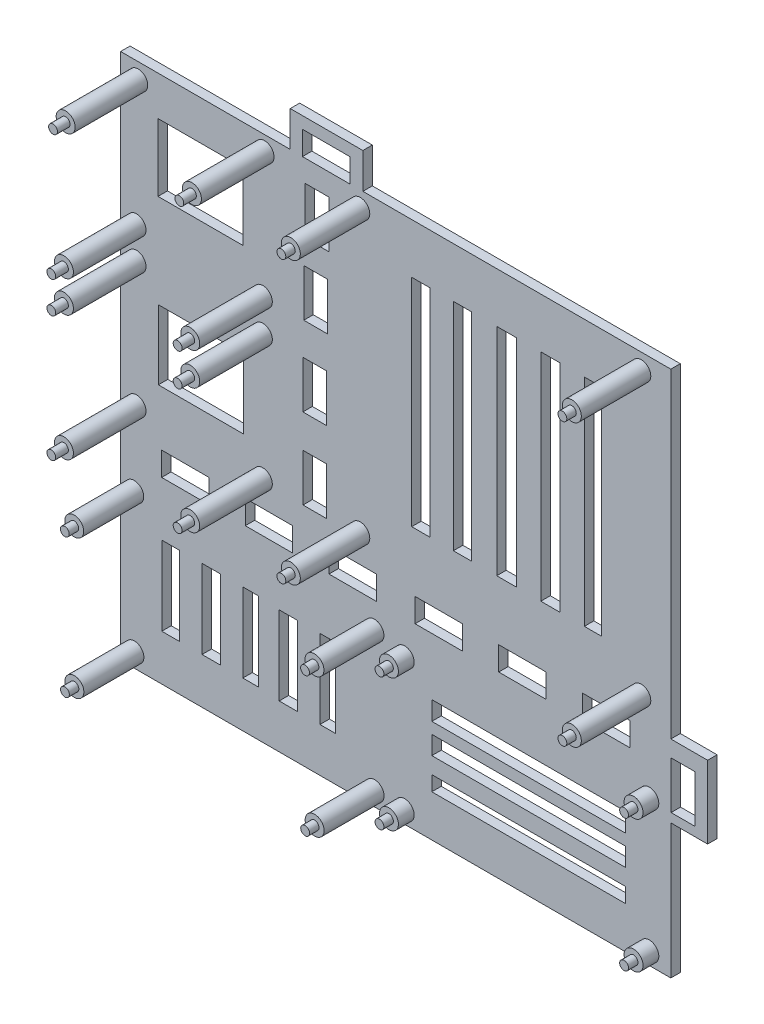
from build123d import *

# Parameters (mm, degrees)
SKETCH1_W            = 15
SKETCH1_H            = 7.5
SKETCH1_R            = 3
SKETCH1_W_2          = 5.688771298
SKETCH1_H_2          = 25
SKETCH1_W_3          = 5.842521873
SKETCH1_W_4          = 4.920018419
SKETCH1_W_5          = 5.842521874
SKETCH1_W_6          = 7.5
SKETCH1_H_3          = 15
SKETCH1_W_7          = 61.334124095
SKETCH1_H_4          = 4.704767614
SKETCH1_H_5          = 5.842521873
SKETCH1_H_6          = 5.974747368
SKETCH1_W_8          = 26.922884563
SKETCH1_H_7          = 21.985461589
SKETCH1_W_9          = 26.922884564
SKETCH1_H_8          = 21.350774687
SKETCH1_W_10         = 5.769189549
SKETCH1_H_9          = 68.406104657
SKETCH1_W_11         = 6.318636173
SKETCH1_W_12         = 6.107283803
SKETCH1_W_13         = 5.494466237
BOSS_EXTRUDE3_DEPTH  = 3
SKETCH1_6_R          = 3
BOSS_EXTRUDE4_DEPTH  = 26
SKETCH1_8_R          = 3
BOSS_EXTRUDE5_DEPTH  = 22
SKETCH1_10_R         = 3
BOSS_EXTRUDE6_DEPTH  = 8
SKETCH1_11_R         = 3
BOSS_EXTRUDE7_DEPTH  = 25
SKETCH1_12_R         = 1.4
BOSS_EXTRUDE8_DEPTH  = 30
SKETCH1_13_R         = 1.4
BOSS_EXTRUDE9_DEPTH  = 25
SKETCH1_15_R         = 1.4
BOSS_EXTRUDE10_DEPTH = 11
SKETCH1_16_R         = 1.4
BOSS_EXTRUDE11_DEPTH = 28


with BuildPart() as part:
    # Sketch1 → Boss-Extrude3 (new body)
    with BuildSketch(Plane.XY):
        Polygon((-20.116410516, 63.581349206), (-73.848571429, 63.581349206), (-73.848571429, -103.418650794), (100.413183268, -103.418650794), (100.413183268, -60.85880545), (112.070531086, -60.85880545), (112.070531086, -37.85880545), (100.413183268, -37.85880545), (100.413183268, 63.581349206), (2.883589484, 63.581349206), (2.883589484, 74.791587762), (-20.116410516, 74.791587762), align=None)
        with Locations((-8.755101848, 67.292277692)):
            Rectangle(SKETCH1_W, SKETCH1_H, mode=Mode.SUBTRACT)
        with Locations((-69.478571429, -98.918650794)):
            Circle(SKETCH1_R, mode=Mode.SUBTRACT)
        with Locations((-57.958212956, -76.416092716)):
            Rectangle(SKETCH1_W_2, SKETCH1_H_2, mode=Mode.SUBTRACT)
        with Locations((-45.120039893, -76.416092716)):
            Rectangle(SKETCH1_W_3, SKETCH1_H_2, mode=Mode.SUBTRACT)
        with Locations((-32.666243269, -76.416092716)):
            Rectangle(SKETCH1_W_4, SKETCH1_H_2, mode=Mode.SUBTRACT)
        with Locations((6.601428571, -98.918650794)):
            Circle(SKETCH1_R, mode=Mode.SUBTRACT)
        with Locations((16.141428571, -99.378650794)):
            Circle(SKETCH1_R, mode=Mode.SUBTRACT)
        with Locations((-20.70673838, -76.953389742)):
            Rectangle(SKETCH1_W_5, SKETCH1_H_2, mode=Mode.SUBTRACT)
        with Locations((-8.252941756, -76.953389742)):
            Rectangle(SKETCH1_W_4, SKETCH1_H_2, mode=Mode.SUBTRACT)
        with Locations((-69.523792896, -54.918650794)):
            Circle(SKETCH1_R, mode=Mode.SUBTRACT)
        with Locations((-53.348571429, -43.000828543)):
            Rectangle(SKETCH1_W, SKETCH1_H, mode=Mode.SUBTRACT)
        with Locations((-68.788571429, -31.080828543)):
            Circle(SKETCH1_R, mode=Mode.SUBTRACT)
        with Locations((-28.788571429, -31.080828543)):
            Circle(SKETCH1_R, mode=Mode.SUBTRACT)
        with Locations((-26.848571429, -43.000828543)):
            Rectangle(SKETCH1_W, SKETCH1_H, mode=Mode.SUBTRACT)
        with Locations((6.556207104, -54.918674032)):
            Circle(SKETCH1_R, mode=Mode.SUBTRACT)
        with Locations((16.141428571, -57.468650794)):
            Circle(SKETCH1_R, mode=Mode.SUBTRACT)
        with Locations((-0.348571429, -43.000828543)):
            Rectangle(SKETCH1_W, SKETCH1_H, mode=Mode.SUBTRACT)
        with Locations((-12.328268413, -24.428475203)):
            Rectangle(SKETCH1_W_6, SKETCH1_H_3, mode=Mode.SUBTRACT)
        with Locations((2.071428571, -30.498650794)):
            Circle(SKETCH1_R, mode=Mode.SUBTRACT)
        with Locations((55.384741084, -87.837938284)):
            Rectangle(SKETCH1_W_7, SKETCH1_H_4, mode=Mode.SUBTRACT)
        with Locations((55.384741084, -77.352149028)):
            Rectangle(SKETCH1_W_7, SKETCH1_H_5, mode=Mode.SUBTRACT)
        with Locations((55.384741084, -67.885726087)):
            Rectangle(SKETCH1_W_7, SKETCH1_H_6, mode=Mode.SUBTRACT)
        with Locations((93.611428571, -99.378650794)):
            Circle(SKETCH1_R, mode=Mode.SUBTRACT)
        with Locations((26.913183268, -43.000828543)):
            Rectangle(SKETCH1_W, SKETCH1_H, mode=Mode.SUBTRACT)
        with Locations((53.413183268, -43.000828543)):
            Rectangle(SKETCH1_W, SKETCH1_H, mode=Mode.SUBTRACT)
        with Locations((79.913183268, -43.000828543)):
            Rectangle(SKETCH1_W, SKETCH1_H, mode=Mode.SUBTRACT)
        with Locations((93.611428571, -57.468650794)):
            Circle(SKETCH1_R, mode=Mode.SUBTRACT)
        with Locations((91.071428571, -30.498650794)):
            Circle(SKETCH1_R, mode=Mode.SUBTRACT)
        with Locations((-48.427249954, -10.882281159)):
            Rectangle(SKETCH1_W_8, SKETCH1_H_7, mode=Mode.SUBTRACT)
        with Locations((-68.788571429, 8.581349206)):
            Circle(SKETCH1_R, mode=Mode.SUBTRACT)
        with Locations((-68.788571429, 18.581349206)):
            Circle(SKETCH1_R, mode=Mode.SUBTRACT)
        with Locations((-28.788571429, 8.581349206)):
            Circle(SKETCH1_R, mode=Mode.SUBTRACT)
        with Locations((-28.788571429, 18.91917133)):
            Circle(SKETCH1_R, mode=Mode.SUBTRACT)
        with Locations((-12.366410516, 1.081349206)):
            Rectangle(SKETCH1_W_6, SKETCH1_H_3, mode=Mode.SUBTRACT)
        with Locations((-12.086484029, 26.376096073)):
            Rectangle(SKETCH1_W_6, SKETCH1_H_3, mode=Mode.SUBTRACT)
        with Locations((-48.537699589, 40.432618375)):
            Rectangle(SKETCH1_W_9, SKETCH1_H_8, mode=Mode.SUBTRACT)
        with Locations((-68.248571429, 58.581349206)):
            Circle(SKETCH1_R, mode=Mode.SUBTRACT)
        with Locations((-28.248571429, 58.91917133)):
            Circle(SKETCH1_R, mode=Mode.SUBTRACT)
        with Locations((-11.636324636, 49.129325276)):
            Rectangle(SKETCH1_W_6, SKETCH1_H_3, mode=Mode.SUBTRACT)
        with Locations((2.071428571, 58.501349206)):
            Circle(SKETCH1_R, mode=Mode.SUBTRACT)
        with Locations((21.24693576, 13.545313947)):
            Rectangle(SKETCH1_W_10, SKETCH1_H_9, mode=Mode.SUBTRACT)
        with Locations((34.433654729, 13.545313947)):
            Rectangle(SKETCH1_W_10, SKETCH1_H_9, mode=Mode.SUBTRACT)
        with Locations((48.444543635, 13.545313947)):
            Rectangle(SKETCH1_W_11, SKETCH1_H_9, mode=Mode.SUBTRACT)
        with Locations((62.286385413, 13.545313947)):
            Rectangle(SKETCH1_W_12, SKETCH1_H_9, mode=Mode.SUBTRACT)
        with Locations((75.779513167, 13.545313947)):
            Rectangle(SKETCH1_W_13, SKETCH1_H_9, mode=Mode.SUBTRACT)
        with Locations((91.071428571, 58.501349206)):
            Circle(SKETCH1_R, mode=Mode.SUBTRACT)
        with Locations((104.249115696, -50.500828543)):
            Rectangle(SKETCH1_W_6, SKETCH1_H_3, mode=Mode.SUBTRACT)
    extrude(amount=BOSS_EXTRUDE3_DEPTH)

    # Sketch1<6> → Boss-Extrude4 (add)
    with BuildSketch(Plane.XY):
        with Locations((-28.788571429, -31.080828543)):
            Circle(SKETCH1_6_R)
        with Locations((-68.788571429, -31.080828543)):
            Circle(SKETCH1_6_R)
        with Locations((-68.788571429, 8.581349206)):
            Circle(SKETCH1_6_R)
        with Locations((-28.788571429, 8.581349206)):
            Circle(SKETCH1_6_R)
        with Locations((-28.788571429, 18.91917133)):
            Circle(SKETCH1_6_R)
        with Locations((-68.788571429, 18.581349206)):
            Circle(SKETCH1_6_R)
        with Locations((-68.248571429, 58.581349206)):
            Circle(SKETCH1_6_R)
        with Locations((-28.248571429, 58.91917133)):
            Circle(SKETCH1_6_R)
    extrude(amount=BOSS_EXTRUDE4_DEPTH)

    # Sketch1<8> → Boss-Extrude5 (add)
    with BuildSketch(Plane.XY):
        with Locations((6.601428571, -98.918650794)):
            Circle(SKETCH1_8_R)
        with Locations((6.556207104, -54.918674032)):
            Circle(SKETCH1_8_R)
        with Locations((-69.523792896, -54.918650794)):
            Circle(SKETCH1_8_R)
        with Locations((-69.478571429, -98.918650794)):
            Circle(SKETCH1_8_R)
    extrude(amount=BOSS_EXTRUDE5_DEPTH)

    # Sketch1<10> → Boss-Extrude6 (add)
    with BuildSketch(Plane.XY):
        with Locations((93.611428571, -99.378650794)):
            Circle(SKETCH1_10_R)
        with Locations((93.611428571, -57.468650794)):
            Circle(SKETCH1_10_R)
        with Locations((16.141428571, -57.468650794)):
            Circle(SKETCH1_10_R)
        with Locations((16.141428571, -99.378650794)):
            Circle(SKETCH1_10_R)
    extrude(amount=BOSS_EXTRUDE6_DEPTH)

    # Sketch1<11> → Boss-Extrude7 (add)
    with BuildSketch(Plane.XY):
        with Locations((91.071428571, 58.501349206)):
            Circle(SKETCH1_11_R)
        with Locations((2.071428571, 58.501349206)):
            Circle(SKETCH1_11_R)
        with Locations((2.071428571, -30.498650794)):
            Circle(SKETCH1_11_R)
        with Locations((91.071428571, -30.498650794)):
            Circle(SKETCH1_11_R)
    extrude(amount=BOSS_EXTRUDE7_DEPTH)

    # Sketch1<12> → Boss-Extrude8 (add)
    with BuildSketch(Plane.XY):
        with Locations((-28.788571429, -31.080828543)):
            Circle(SKETCH1_12_R)
        with Locations((-68.788571429, -31.080828543)):
            Circle(SKETCH1_12_R)
        with Locations((-68.788571429, 8.581349206)):
            Circle(SKETCH1_12_R)
        with Locations((-68.788571429, 18.581349206)):
            Circle(SKETCH1_12_R)
        with Locations((-28.788571429, 18.91917133)):
            Circle(SKETCH1_12_R)
        with Locations((-68.248571429, 58.581349206)):
            Circle(SKETCH1_12_R)
        with Locations((-28.248571429, 58.91917133)):
            Circle(SKETCH1_12_R)
        with Locations((-28.788571429, 8.581349206)):
            Circle(SKETCH1_12_R)
    extrude(amount=BOSS_EXTRUDE8_DEPTH)

    # Sketch1<13> → Boss-Extrude9 (add)
    with BuildSketch(Plane.XY):
        with Locations((6.556207104, -54.918674032)):
            Circle(SKETCH1_13_R)
        with Locations((6.601428571, -98.918650794)):
            Circle(SKETCH1_13_R)
        with Locations((-69.523792896, -54.918650794)):
            Circle(SKETCH1_13_R)
        with Locations((-69.478571429, -98.918650794)):
            Circle(SKETCH1_13_R)
    extrude(amount=BOSS_EXTRUDE9_DEPTH)

    # Sketch1<15> → Boss-Extrude10 (add)
    with BuildSketch(Plane.XY):
        with Locations((93.611428571, -57.468650794)):
            Circle(SKETCH1_15_R)
        with Locations((93.611428571, -99.378650794)):
            Circle(SKETCH1_15_R)
        with Locations((16.141428571, -99.378650794)):
            Circle(SKETCH1_15_R)
        with Locations((16.141428571, -57.468650794)):
            Circle(SKETCH1_15_R)
    extrude(amount=BOSS_EXTRUDE10_DEPTH)

    # Sketch1<16> → Boss-Extrude11 (add)
    with BuildSketch(Plane.XY):
        with Locations((91.071428571, 58.501349206)):
            Circle(SKETCH1_16_R)
        with Locations((91.071428571, -30.498650794)):
            Circle(SKETCH1_16_R)
        with Locations((2.071428571, -30.498650794)):
            Circle(SKETCH1_16_R)
        with Locations((2.071428571, 58.501349206)):
            Circle(SKETCH1_16_R)
    extrude(amount=BOSS_EXTRUDE11_DEPTH)


solid = part.part
